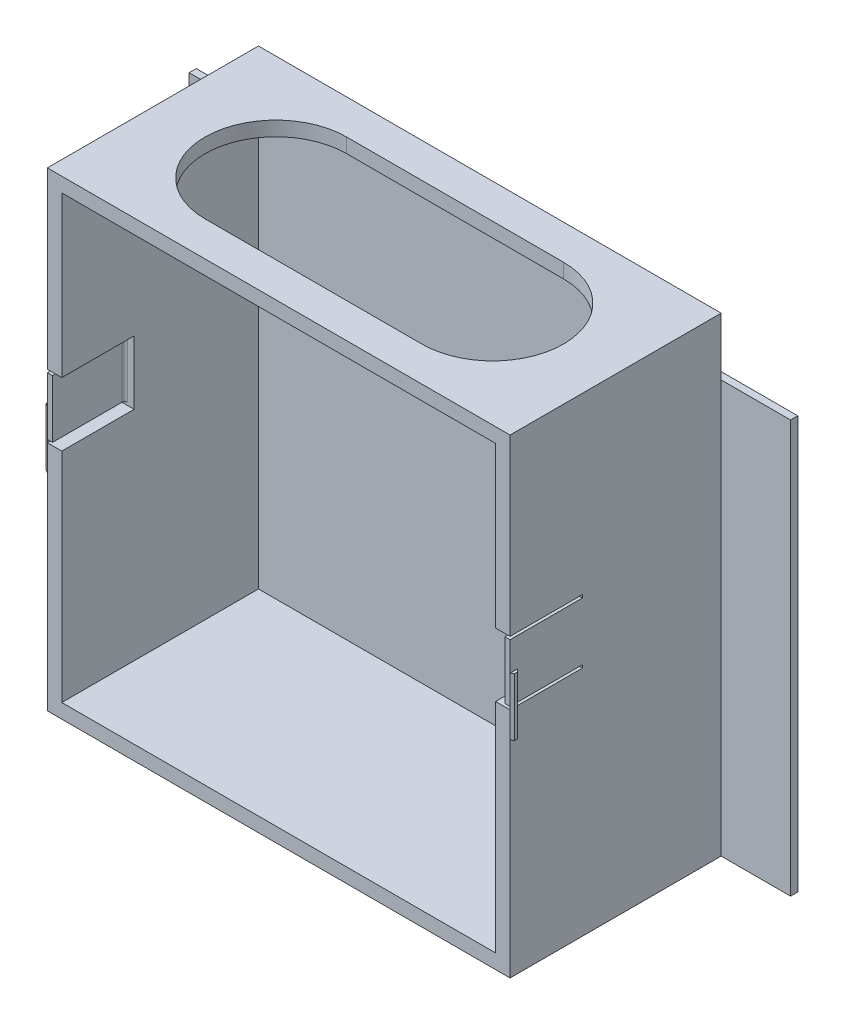
from build123d import *

# Parameters (mm, degrees)
SKETCH2_W            = 203.2
SKETCH2_H            = 92.71
BOSS_EXTRUDE1_DEPTH  = 206.502
SKETCH3_W            = 190.5
SKETCH3_H            = 193.802
CUT_EXTRUDE1_DEPTH   = 86.36
CUT_EXTRUDE2_REACH   = 236.765
SKETCH6_W            = 264.16
SKETCH6_H            = 181.102
BOSS_EXTRUDE2_DEPTH  = 3.175
SKETCH8_W            = 4.064
SKETCH8_H            = 25.4
SKETCH8_W_2          = 6.35
SKETCH8_H_2          = 1.27
CUT_EXTRUDE3_DEPTH   = 31.75
FILLET1_R            = 1.27
BOSS_EXTRUDE3_DEPTH  = 12.7
FILLET1_OF_MIRROR1_R = 1.27


with BuildPart() as part:
    # Sketch2 → Boss-Extrude1 (new body)
    with BuildSketch(Plane(origin=(0, 0, 0), x_dir=(1, 0, 0), z_dir=(0, 1, 0))):
        Rectangle(SKETCH2_W, SKETCH2_H)
    extrude(amount=BOSS_EXTRUDE1_DEPTH)

    # Sketch3 → Cut-Extrude1 (cut)
    with BuildSketch(Plane.XY.offset(46.355)):
        with Locations((0, 103.251)):
            Rectangle(SKETCH3_W, SKETCH3_H)
    extrude(amount=-CUT_EXTRUDE1_DEPTH, mode=Mode.SUBTRACT)

    # Sketch5 → Cut-Extrude2 (cut, up to next)
    with BuildSketch(Plane.XZ.offset(-206.502), mode=Mode.PRIVATE) as cut_extrude2_sk1:
        with BuildLine():
            Line((-47.625, 31.115), (47.625, 31.115))
            ThreePointArc((47.625, 31.115), (78.74, 0), (47.625, -31.115))
            Line((47.625, -31.115), (-47.625, -31.115))
            ThreePointArc((-47.625, -31.115), (-78.74, 0), (-47.625, 31.115))
        make_face()
    cut_extrude2_tool1 = extrude(cut_extrude2_sk1.sketch, amount=CUT_EXTRUDE2_REACH, mode=Mode.PRIVATE) & part.part
    add(cut_extrude2_tool1.solids().sort_by_distance((0, 206.502, 0))[0], mode=Mode.SUBTRACT)

    # Sketch6 → Boss-Extrude2 (add)
    with BuildSketch(Plane(origin=(0, 0, -46.355), x_dir=(-1, 0, 0), z_dir=(0, 0, -1))):
        with Locations((0, 90.551)):
            Rectangle(SKETCH6_W, SKETCH6_H)
    extrude(amount=BOSS_EXTRUDE2_DEPTH)

    # Sketch8 → Cut-Extrude3 (cut)
    with BuildSketch(Plane.XY.offset(46.355)):
        with Locations((-97.282, 115.951)):
            Rectangle(SKETCH8_W, SKETCH8_H)
        Polygon((-95.25, 103.251), (-99.314, 103.251), (-101.6, 103.251), (-101.6, 101.981), (-95.25, 101.981), align=None)
        with Locations((-98.425, 129.286)):
            Rectangle(SKETCH8_W_2, SKETCH8_H_2)
    cut_extrude3 = extrude(amount=-CUT_EXTRUDE3_DEPTH, mode=Mode.SUBTRACT)

    # Fillet1
    fillet1_edges = [part.edges().sort_by_distance(p)[0] for p in [
        (-99.314, 115.951, 14.605),
    ]]
    fillet(fillet1_edges, radius=FILLET1_R)

    # Sketch10 → Boss-Extrude3 (add, symmetric)
    with BuildSketch(Plane(origin=(0, 103.251, 0), x_dir=(-1, 0, 0), z_dir=(0, -1, 0))):
        Polygon((101.6, -46.355), (102.807721606, -45.657721606), (102.807721606, -44.387721606), (101.6, -43.18), align=None)
    boss_extrude3 = extrude(amount=BOSS_EXTRUDE3_DEPTH, both=True)

    # Mirror1: Cut-Extrude3, Boss-Extrude3 across plane
    add(cut_extrude3.mirror(Plane(origin=(0, 0, 0), x_dir=(0, 0, 1), z_dir=(1, 0, 0))), mode=Mode.SUBTRACT)
    add(boss_extrude3.mirror(Plane(origin=(0, 0, 0), x_dir=(0, 0, 1), z_dir=(1, 0, 0))))

    # Fillet1 of Mirror1
    fillet1_of_mirror1_edges = [part.edges().sort_by_distance(p)[0] for p in [
        (99.314, 115.951, 14.605),
    ]]
    fillet(fillet1_of_mirror1_edges, radius=FILLET1_OF_MIRROR1_R)


solid = part.part
